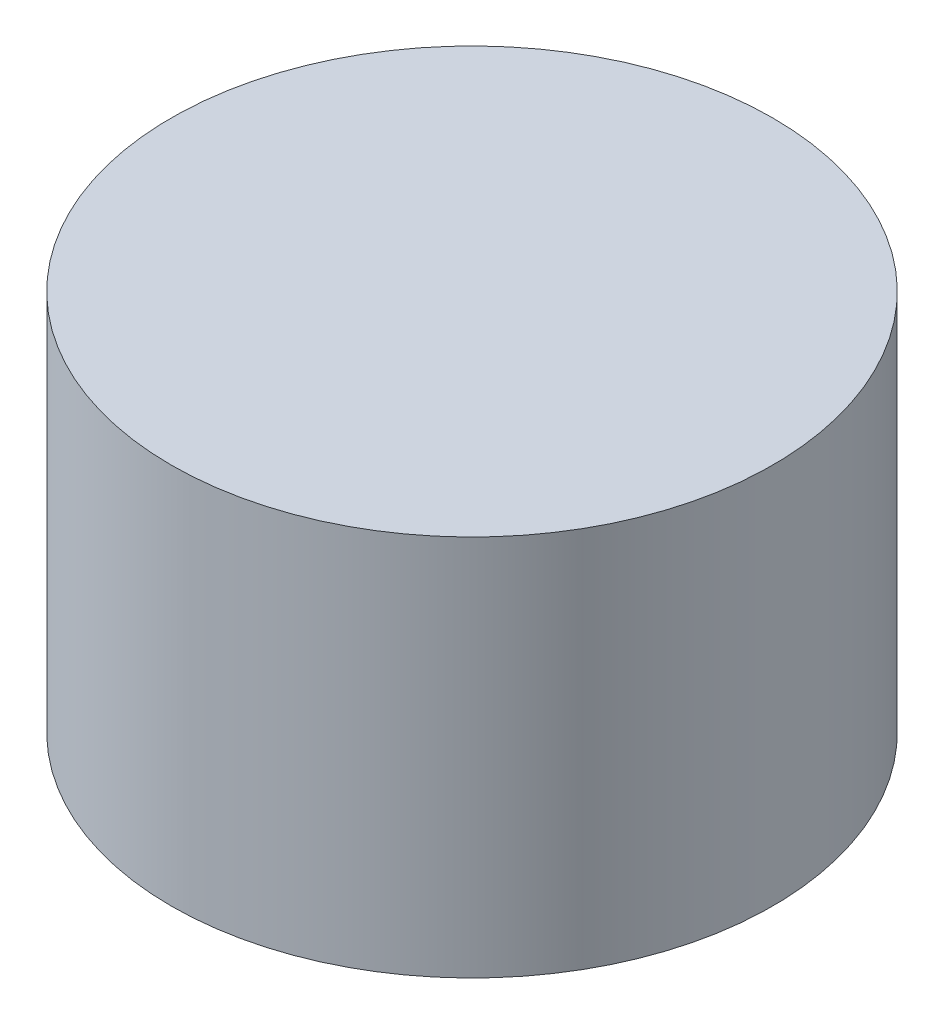
from build123d import *

# Parameters (mm, degrees)
SKETCH1_R           = 2.5
BOSS_EXTRUDE1_DEPTH = 3.175


with BuildPart() as part:
    # Sketch1 → Boss-Extrude1 (new body)
    with BuildSketch(Plane(origin=(0, 0, 0), x_dir=(1, 0, 0), z_dir=(0, 1, 0))):
        with Locations(Location((0, 0, 0), (0, 0, 270))):
            Circle(SKETCH1_R)
    extrude(amount=BOSS_EXTRUDE1_DEPTH)


solid = part.part
